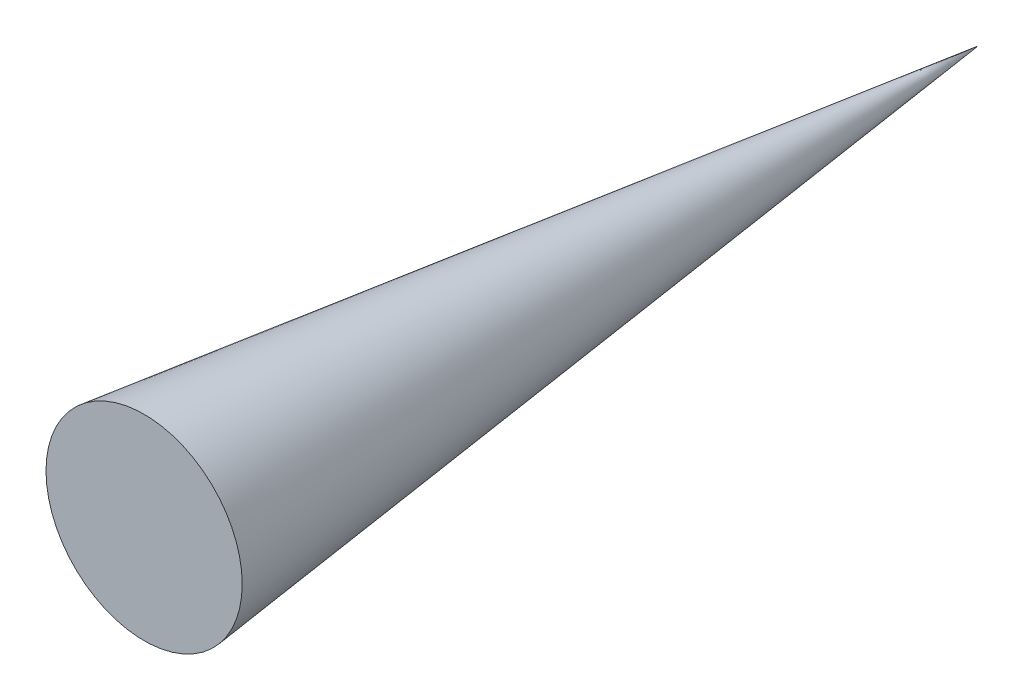
from build123d import *


with BuildPart() as part:
    # Sketch3 → Revolve1 (revolve)
    with BuildSketch(Plane(origin=(0, 0, 0), x_dir=(1, 0, 0), z_dir=(0, 1, 0)), mode=Mode.PRIVATE) as revolve1_sk:
        Polygon((-14.166894013, 20.216875821), (-14.166894013, 3.216875821), (-16.166894013, 3.216875821), align=None)
    revolve(revolve1_sk.sketch.rotate(Axis((-14.166894013, 0, -24.41070842), (0, 0, 1)), 180), axis=Axis((-14.166894013, 0, -24.41070842), (0, 0, 1)))


solid = part.part
